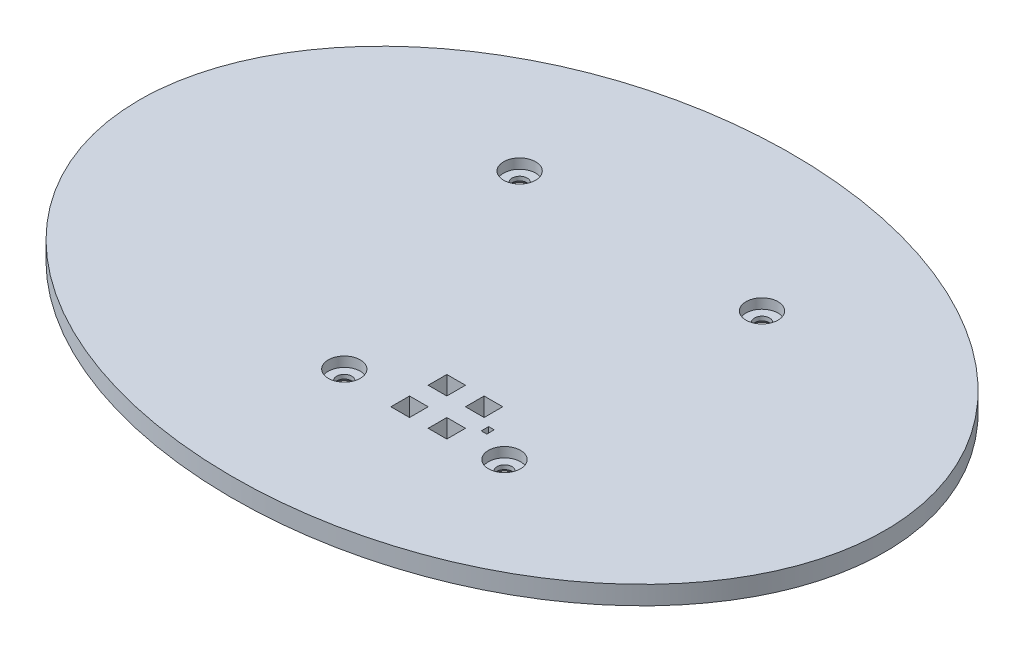
from build123d import *

# Parameters (mm, degrees)
SKETCH2_RX                                   = 50.8
SKETCH2_RY                                   = 38.1
TOP_DEPTH                                    = 2.54
SKETCH4_W                                    = 2.54
SKETCH4_H                                    = 2.54
SKETCH4_W_2                                  = 0.762
SKETCH4_H_2                                  = 1.016
BUTTONS_AND_LED_DEPTH                        = 2.54
CBORE_FOR_1_PAN_HEAD_MACHINE_SCREW1_AT_COUNT = 2
CBORE_FOR_1_PAN_HEAD_MACHINE_SCREW1_AT_PITCH = 21.591313149
CBORE_FOR_1_PAN_HEAD_MACHINE_SCREW1_2_COUNT  = 2
CBORE_FOR_1_PAN_HEAD_MACHINE_SCREW1_2_PITCH  = 41.397620143
CBORE_FOR_1_PAN_HEAD_MACHINE_SCREW1_3_COUNT  = 2
CBORE_FOR_1_PAN_HEAD_MACHINE_SCREW1_3_PITCH  = 37.125190283


with BuildPart() as part:
    # Sketch2 → top (new body)
    with BuildSketch(Plane(origin=(0, 0, 0), x_dir=(1, 0, 0), z_dir=(0, 1, 0))):
        with Locations(Location((0, 0), (0, 0, 180))):
            Ellipse(SKETCH2_RX, SKETCH2_RY)
    extrude(amount=TOP_DEPTH)

    # Sketch4 → buttons and LED (cut)
    with BuildSketch(Plane(origin=(0, 2.54, 0), x_dir=(1, 0, 0), z_dir=(0, 1, 0))):
        with Locations((8.89, -17.78)):
            Rectangle(SKETCH4_W, SKETCH4_H)
        with Locations((8.89, -12.7)):
            Rectangle(SKETCH4_W, SKETCH4_H)
        with Locations((3.81, -17.78)):
            Rectangle(SKETCH4_W, SKETCH4_H)
        with Locations((3.81, -12.7)):
            Rectangle(SKETCH4_W, SKETCH4_H)
        with Locations((11.918930211, -15.24)):
            Rectangle(SKETCH4_W_2, SKETCH4_H_2)
    extrude(amount=-BUTTONS_AND_LED_DEPTH, mode=Mode.SUBTRACT)

    # Sketch5 → CBORE for #1 Pan Head Machine Screw1 (revolve, cut)
    with BuildSketch(Plane(origin=(-5.08, 2.54, 17.78), x_dir=(0, 0, 1), z_dir=(1, 0, 0))):
        Polygon((0, 0), (0, 2.54), (1.6637, 2.54), (1.0287, 1.905), (1.0287, 1.3462), (2.18313, 1.3462), (2.18313, 0), align=None)
    cbore_for_1_pan_head_machine_screw1 = revolve(axis=Axis((-5.08, 8.89, 17.78), (0, -1, 0)), mode=Mode.SUBTRACT)

    # CBORE for #1 Pan Head Machine Screw1 at: CBORE for #1 Pan Head Machine Screw1 ×2
    with Locations(*[Vector(0.9999391815868314, 0, -0.011028740973384169) * (i * CBORE_FOR_1_PAN_HEAD_MACHINE_SCREW1_AT_PITCH) for i in range(1, CBORE_FOR_1_PAN_HEAD_MACHINE_SCREW1_AT_COUNT)]):
        add(cbore_for_1_pan_head_machine_screw1, mode=Mode.SUBTRACT)

    # CBORE for _1 Pan Head Machine Screw1 2: CBORE for #1 Pan Head Machine Screw1 ×2
    with Locations(*[Vector(0.5215275642742045, 0, -0.8532344341986062) * (i * CBORE_FOR_1_PAN_HEAD_MACHINE_SCREW1_2_PITCH) for i in range(1, CBORE_FOR_1_PAN_HEAD_MACHINE_SCREW1_2_COUNT)]):
        add(cbore_for_1_pan_head_machine_screw1, mode=Mode.SUBTRACT)

    # CBORE for _1 Pan Head Machine Screw1 3: CBORE for #1 Pan Head Machine Screw1 ×2
    with Locations(*[Vector(-0.3078772098677194, 0, -0.9514260999384389) * (i * CBORE_FOR_1_PAN_HEAD_MACHINE_SCREW1_3_PITCH) for i in range(1, CBORE_FOR_1_PAN_HEAD_MACHINE_SCREW1_3_COUNT)]):
        add(cbore_for_1_pan_head_machine_screw1, mode=Mode.SUBTRACT)


solid = part.part
